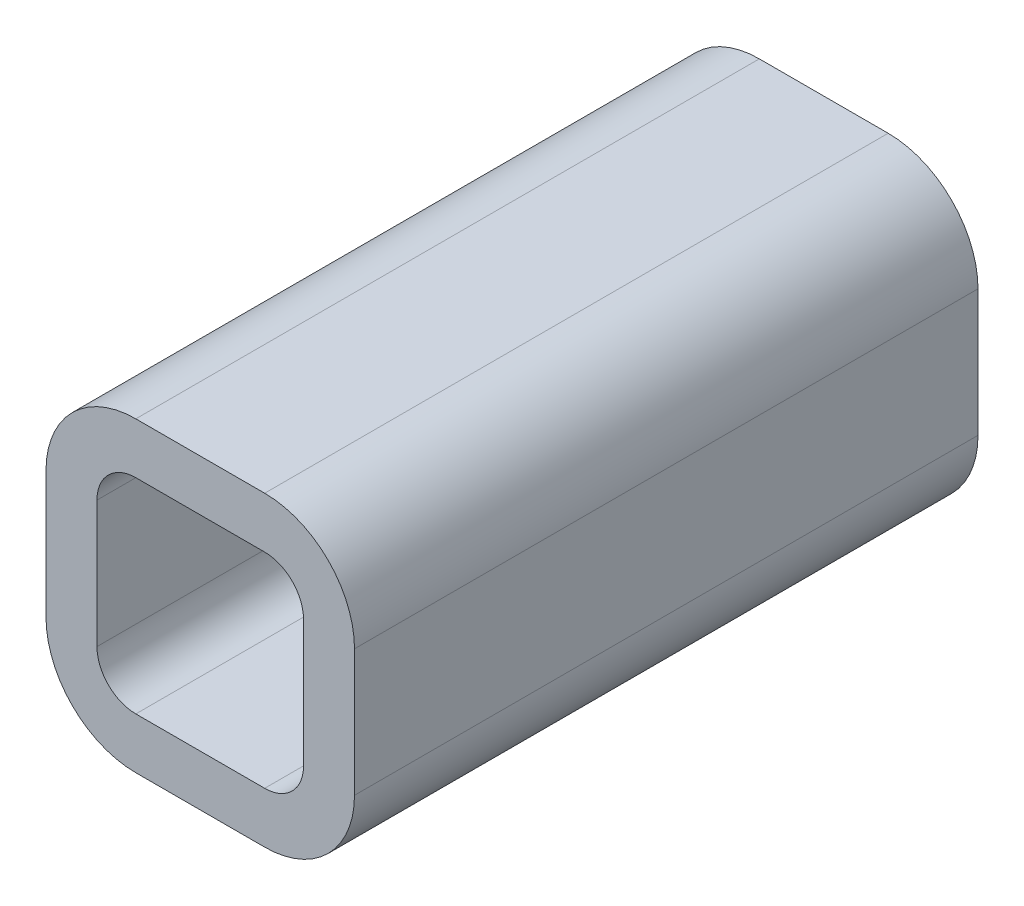
from build123d import *

# Parameters (mm, degrees)
SKETCH1_R           = 1.7
BOSS_EXTRUDE1_DEPTH = 34.5
CUT_EXTRUDE1_DEPTH  = 20.5
CUT_EXTRUDE2_START  = -7
CUT_EXTRUDE2_DEPTH  = 7


with BuildPart() as part:
    # Sketch1 → Boss-Extrude1 (new body)
    with BuildSketch(Plane.XY):
        with BuildLine():
            Line((-1.71, 8.48), (5.42, 8.48))
            ThreePointArc((5.42, 8.48), (8.934320702, 7.024320703), (10.39, 3.51))
            Line((10.39, 3.51), (10.39, -3.510005593))
            ThreePointArc((10.39, -3.510005593), (8.934320702, -7.024326295), (5.42, -8.480005593))
            Line((5.42, -8.480005593), (-1.71, -8.480005593))
            ThreePointArc((-1.71, -8.480005593), (-5.224320703, -7.024326295), (-6.68, -3.510005593))
            Line((-6.68, -3.510005593), (-6.68, 3.51))
            ThreePointArc((-6.68, 3.51), (-5.224320703, 7.024320703), (-1.71, 8.48))
        make_face()
        Circle(SKETCH1_R, mode=Mode.SUBTRACT)
        with BuildLine():
            Line((3.708402898, 2.999994407), (3.708402898, -2.999994407))
            ThreePointArc((3.708402898, -2.999994407), (3.854849507, -3.353547798), (4.208402898, -3.499994407))
            Line((4.208402898, -3.499994407), (4.808402898, -3.499994407))
            ThreePointArc((4.808402898, -3.499994407), (5.161956288, -3.353547798), (5.308402898, -2.999994407))
            Line((5.308402898, -2.999994407), (5.308402898, 2.999994407))
            ThreePointArc((5.308402898, 2.999994407), (5.161956288, 3.353547798), (4.808402898, 3.499994407))
            Line((4.808402898, 3.499994407), (4.208402898, 3.499994407))
            ThreePointArc((4.208402898, 3.499994407), (3.854849507, 3.353547798), (3.708402898, 2.999994407))
        make_face(mode=Mode.SUBTRACT)
    extrude(amount=BOSS_EXTRUDE1_DEPTH)

    # Sketch2 → Cut-Extrude1 (cut)
    with BuildSketch(Plane.XY.offset(34.5)):
        with BuildLine():
            Line((7.57000536, -3.509982547), (7.56999464, 3.510017453))
            ThreePointArc((7.56999464, 3.510017453), (6.94026805, 5.03028575), (5.419994641, 5.66))
            Line((5.419994641, 5.66), (-1.71000536, 5.66))
            ThreePointArc((-1.71000536, 5.66), (-3.230284939, 5.03027958), (-3.86000536, 3.51))
            Line((-3.86000536, 3.51), (-3.85999464, -3.51))
            ThreePointArc((-3.85999464, -3.51), (-3.230271899, -5.030278618), (-1.709991358, -5.659996717))
            Line((-1.709991358, -5.659996717), (5.420008642, -5.65998583))
            ThreePointArc((5.420008642, -5.65998583), (6.94028726, -5.030263088), (7.57000536, -3.509982547))
        make_face()
    extrude(amount=-CUT_EXTRUDE1_DEPTH, mode=Mode.SUBTRACT)

    # Sketch3 → Cut-Extrude2 (cut)
    with BuildSketch(Plane.XY.offset(14).offset(CUT_EXTRUDE2_START)):
        with BuildLine():
            Line((5.508402898, 3.499994407), (4.208402898, 3.499994407))
            ThreePointArc((4.208402898, 3.499994407), (3.854849507, 3.353547798), (3.708402898, 2.999994407))
            Line((3.708402898, 2.999994407), (3.708402898, -2.999994407))
            ThreePointArc((3.708402898, -2.999994407), (3.854849507, -3.353547798), (4.208402898, -3.499994407))
            Line((4.208402898, -3.499994407), (5.508402898, -3.499994407))
            ThreePointArc((5.508402898, -3.499994407), (5.861956288, -3.353547798), (6.008402898, -2.999994407))
            Line((6.008402898, -2.999994407), (6.008402898, 2.999994407))
            ThreePointArc((6.008402898, 2.999994407), (5.861956288, 3.353547798), (5.508402898, 3.499994407))
        make_face()
    extrude(amount=CUT_EXTRUDE2_DEPTH, mode=Mode.SUBTRACT)


solid = part.part
